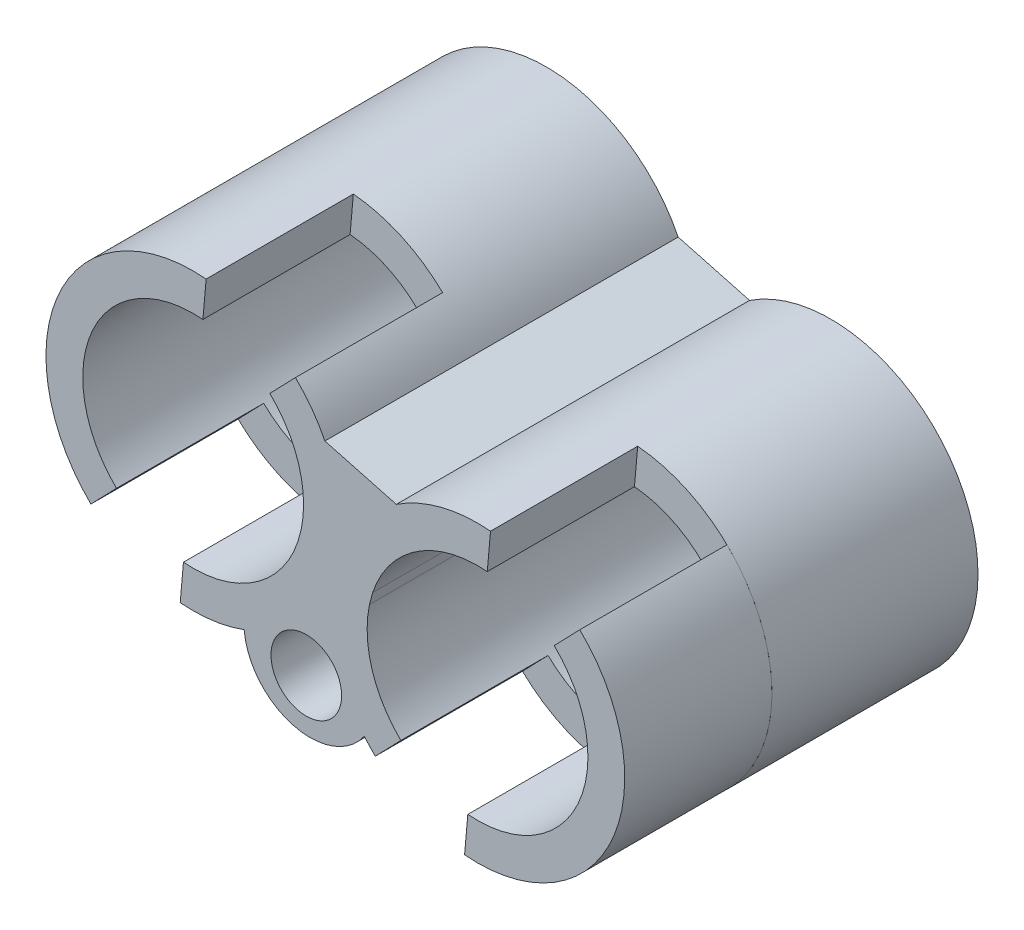
from build123d import *
from build123d.topology import SkipClean

# Parameters (mm, degrees)
SKETCH1_R             = 7.5
SKETCH1_R_2           = 3.285
BOSS_EXTRUDE1_DEPTH   = 2
BOSS_EXTRUDE1_2_DEPTH = 2
SKETCH1_3_R           = 10
SKETCH1_3_R_2         = 7.5
BOSS_EXTRUDE2_DEPTH   = 14
BOSS_EXTRUDE3_DEPTH   = 10
BOSS_EXTRUDE4_DEPTH   = 24
SKETCH5_R             = 4.496880173
BOSS_EXTRUDE5_DEPTH   = 24
SKETCH6_R             = 2.4
CUT_EXTRUDE1_DEPTH    = 10


with BuildPart() as part:
    # Sketch1 → Boss-Extrude1 (new body)
    with BuildSketch(Plane.XY):
        Circle(SKETCH1_R)
        Circle(SKETCH1_R_2, mode=Mode.SUBTRACT)
    extrude(amount=BOSS_EXTRUDE1_DEPTH)

    # Sketch1<3> → Boss-Extrude2 (add)
    # profile 1 of 2: a face of its own
    with BuildSketch(Plane.XY):
        Circle(SKETCH1_3_R)
        Circle(SKETCH1_3_R_2, mode=Mode.SUBTRACT)
    # profile 2 of 2: a face of its own
    with BuildSketch(Plane.XY):
        with Locations((19.318516526, -5.176380902)):
            Circle(SKETCH1_3_R)
        with Locations((19.318516526, -5.176380902)):
            Circle(SKETCH1_3_R_2, mode=Mode.SUBTRACT)
    extrude(amount=BOSS_EXTRUDE2_DEPTH)


with BuildPart() as body_2:
    # Sketch1 → Boss-Extrude1 2 (new body)
    with BuildSketch(Plane.XY):
        with Locations((19.318516526, -5.176380902)):
            Circle(SKETCH1_R)
        with Locations((19.318516526, -5.176380902)):
            Circle(SKETCH1_R_2, mode=Mode.SUBTRACT)
    extrude(amount=BOSS_EXTRUDE1_2_DEPTH)



with BuildPart() as boss_extrude2_piece_1:
    # of the separate pieces the step leaves, piece 1, a body of its own (boss_extrude2_pieces)
    add(part.part.solids().sort_by_distance((3.285, 0, 0))[0])

    # Sketch2 → Boss-Extrude3 (add)
    with SkipClean():  # the faces are left unmerged after this step: merging them gives an invalid solid
        with BuildSketch(Plane.XY.offset(14)):
            with BuildLine():
                ThreePointArc((0.880723614, 9.961140794), (-9.097879067, 4.150734451), (-6.945976325, -7.193984493))
                Line((-6.945976325, -7.193984493), (-5.209482244, -5.39548837))
                ThreePointArc((-5.209482244, -5.39548837), (-6.8234093, 3.113050838), (0.66054271, 7.470855595))
                Line((0.66054271, 7.470855595), (0.880723614, 9.961140794))
            make_face()
            with BuildLine():
                Line((-0.66054271, -7.470855595), (-0.880723614, -9.961140794))
                ThreePointArc((-0.880723614, -9.961140794), (5.731995045, -8.194158456), (9.659258283, -2.588190376))
                ThreePointArc((9.659258283, -2.588190376), (9.914448619, -1.305261884), (10, 0))
                ThreePointArc((10, 0), (9.204883575, 3.907699883), (6.945976325, 7.193984493))
                Line((6.945976325, 7.193984493), (5.209482244, 5.39548837))
                ThreePointArc((5.209482244, 5.39548837), (6.903662681, 2.930774912), (7.5, 0))
                ThreePointArc((7.5, 0), (5.06438198, -5.531910625), (-0.66054271, -7.470855595))
            make_face()
            with BuildLine():
                ThreePointArc((20.199240139, 4.784759892), (13.586521544, 3.017777598), (9.659258283, -2.588190376))
                ThreePointArc((9.659258283, -2.588190376), (9.68232481, -7.849171431), (12.372540201, -12.370365396))
                Line((12.372540201, -12.370365396), (14.109034282, -10.571869272))
                ThreePointArc((14.109034282, -10.571869272), (12.495107225, -2.063330064), (19.979059236, 2.294474693))
                Line((19.979059236, 2.294474693), (20.199240139, 4.784759892))
            make_face()
            with BuildLine():
                ThreePointArc((29.318516526, -5.176380902), (28.523400101, -1.268681019), (26.264492851, 2.017603591))
                Line((26.264492851, 2.017603591), (24.52799877, 0.219107468))
                ThreePointArc((24.52799877, 0.219107468), (26.222179207, -2.24560599), (26.818516526, -5.176380902))
                ThreePointArc((26.818516526, -5.176380902), (24.382898506, -10.708291527), (18.657973816, -12.647236497))
                Line((18.657973816, -12.647236497), (18.437792912, -15.137521696))
                ThreePointArc((18.437792912, -15.137521696), (26.071025832, -12.552261735), (29.318516526, -5.176380902))
            make_face()
        extrude(amount=BOSS_EXTRUDE3_DEPTH)


with BuildPart() as boss_extrude2_piece_2:
    # of the separate pieces the step leaves, piece 2, a body of its own (boss_extrude2_pieces)
    add(part.part.solids().sort_by_distance((29.318516526, -5.176380902, 0))[0])


with BuildPart() as boss_extrude3_piece_1:
    # of the separate pieces the step leaves, piece 1, a body of its own (boss_extrude3_pieces)
    add(boss_extrude2_piece_1.part.solids().sort_by_distance((3.285, 0, 0))[0])


with BuildPart() as boss_extrude3_piece_2:
    # of the separate pieces the step leaves, piece 2, a body of its own (boss_extrude3_pieces)
    add(boss_extrude2_piece_1.part.solids().sort_by_distance((18.437792912, -15.137521696, 14))[0])


with BuildPart() as boss_extrude3_piece_3:
    # of the separate pieces the step leaves, piece 3, a body of its own (boss_extrude3_pieces)
    add(boss_extrude2_piece_1.part.solids().sort_by_distance((20.199240139, 4.784759892, 14))[0])


with BuildPart() as body_2_1:
    with SkipClean():  # the faces are left unmerged after this step: merging them gives an invalid solid
        add(body_2.part)

        add(boss_extrude2_piece_2.part)  # Boss-Extrude4 merges Boss-Extrude2 piece 2

        add(boss_extrude3_piece_1.part)  # Boss-Extrude4 merges Boss-Extrude3 piece 1

        add(boss_extrude3_piece_3.part)  # Boss-Extrude4 merges Boss-Extrude3 piece 3
        # Sketch4 → Boss-Extrude4 (add)
        with BuildSketch(Plane.XY.offset(24)):
            Polygon((13.800709497, 3.163511519), (8.948507271, 4.463655187), (5.517807029, -8.339892421), (10.370009255, -9.640036089), align=None)
        extrude(amount=-BOSS_EXTRUDE4_DEPTH)

    # Sketch5 → Boss-Extrude5 (add)
    with SkipClean():  # the faces are left unmerged after this step: merging them gives an invalid solid
        with BuildSketch(Plane.XY.offset(24)):
            with Locations((7.943908142, -8.989964255)):
                Circle(SKETCH5_R)
        extrude(amount=-BOSS_EXTRUDE5_DEPTH)

    # Sketch6 → Cut-Extrude1 (cut)
    with SkipClean():  # the faces are left unmerged after this step: merging them gives an invalid solid
        with BuildSketch(Plane.XY.offset(24)):
            with Locations((7.685089097, -9.955890081)):
                Circle(SKETCH6_R)
        extrude(amount=-CUT_EXTRUDE1_DEPTH, mode=Mode.SUBTRACT)


solid = Compound([boss_extrude3_piece_2.part, body_2_1.part])
